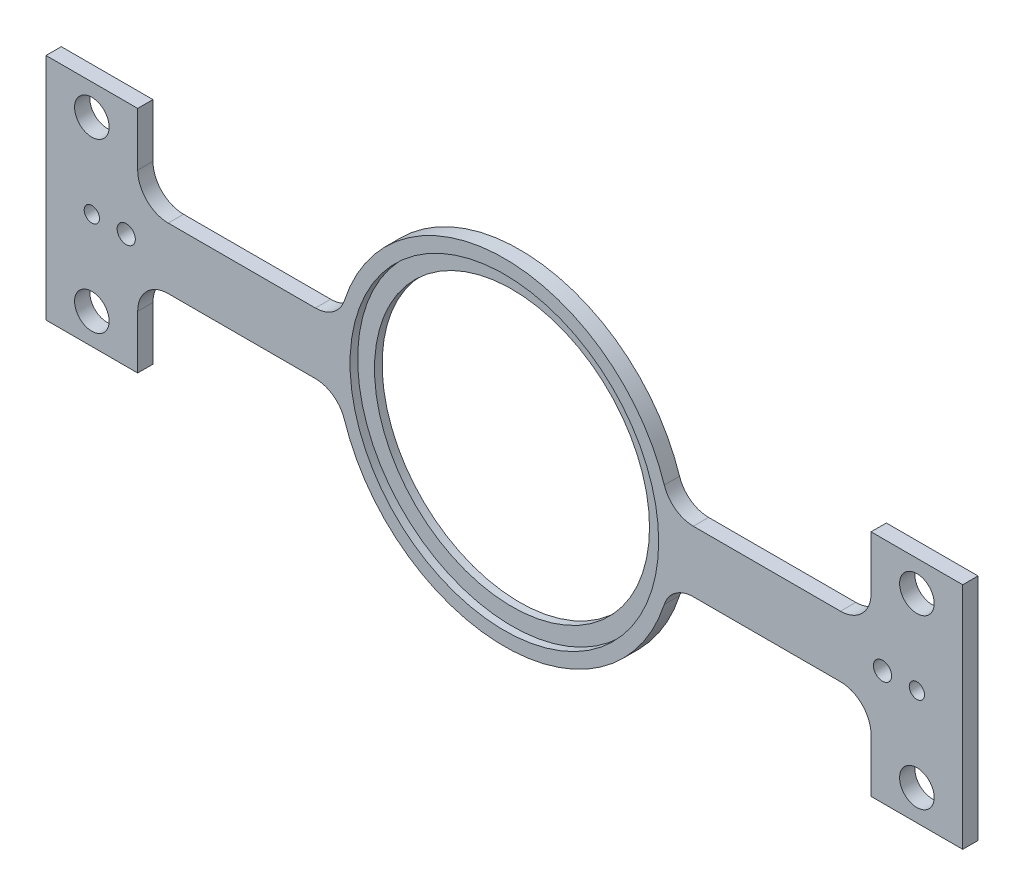
from build123d import *

# Parameters (mm, degrees)
SKETCH1_R             = 9
BOSS_EXTRUDE1_DEPTH   = 1
SKETCH2_R             = 10.1
CUT_EXTRUDE1_DEPTH    = 0.5
SKETCH6_R             = 0.5
CUT_EXTRUDE3_DEPTH    = 32.968734726
F_1_CLEARANCE_HOLE1_D = 2.2606
F_0_80_TAPPED_HOLE1_D = 1.19126
FILLET1_R             = 2


with BuildPart() as part:
    # Sketch1 → Boss-Extrude1 (new body)
    with BuildSketch(Plane.XY):
        with BuildLine():
            Line((10.816653826, 2), (24, 2))
            Line((24, 2), (24, 7.5))
            Line((24, 7.5), (30, 7.5))
            Line((30, 7.5), (30, -7.5))
            Line((30, -7.5), (24, -7.5))
            Line((24, -7.5), (24, -2))
            Line((24, -2), (10.816653826, -2))
            ThreePointArc((10.816653826, -2), (0, -11), (-10.816653826, -2))
            Line((-10.816653826, -2), (-24, -2))
            Line((-24, -2), (-24, -7.5))
            Line((-24, -7.5), (-30, -7.5))
            Line((-30, -7.5), (-30, 7.5))
            Line((-30, 7.5), (-24, 7.5))
            Line((-24, 7.5), (-24, 2))
            Line((-24, 2), (-10.816653826, 2))
            ThreePointArc((-10.816653826, 2), (0, 11), (10.816653826, 2))
        make_face()
        Circle(SKETCH1_R, mode=Mode.SUBTRACT)
    extrude(amount=BOSS_EXTRUDE1_DEPTH)

    # Sketch2 → Cut-Extrude1 (cut)
    with BuildSketch(Plane.XY.offset(1)):
        Circle(SKETCH2_R)
    extrude(amount=-CUT_EXTRUDE1_DEPTH, mode=Mode.SUBTRACT)

    # Sketch6 → Cut-Extrude3 (cut, through all)
    with BuildSketch(Plane(origin=(0, 0, 0), x_dir=(-1, 0, 0), z_dir=(0, 0, -1))):
        with Locations((-27, 0)):
            Circle(SKETCH6_R)
        with Locations((27, 0)):
            Circle(SKETCH6_R)
    extrude(amount=-CUT_EXTRUDE3_DEPTH, mode=Mode.SUBTRACT)

    # #1 Clearance Hole1 (through all)
    with Locations(Plane(origin=(0, 0, 0), x_dir=(-1, 0, 0), z_dir=(0, 0, -1))):
        with Locations((-27, -5.5), (-27, 5.5), (27, 5.5), (27, -5.5)):
            Hole(F_1_CLEARANCE_HOLE1_D / 2)

    # #0-80 Tapped Hole1 (through all)
    with Locations(Plane(origin=(0, 0, 0), x_dir=(-1, 0, 0), z_dir=(0, 0, -1))):
        with Locations((-24.75, 0), (24.75, 0)):
            Hole(F_0_80_TAPPED_HOLE1_D / 2)

    # Fillet1
    fillet1_edges = [part.edges().sort_by_distance(p)[0] for p in [
        (-24, 2, 0.5),
        (-10.816653826, 2, 0.5),
        (10.816653826, 2, 0.5),
        (24, 2, 0.5),
        (24, -2, 0.5),
        (10.816653826, -2, 0.5),
        (-10.816653826, -2, 0.5),
        (-24, -2, 0.5),
    ]]
    fillet(fillet1_edges, radius=FILLET1_R)


solid = part.part
